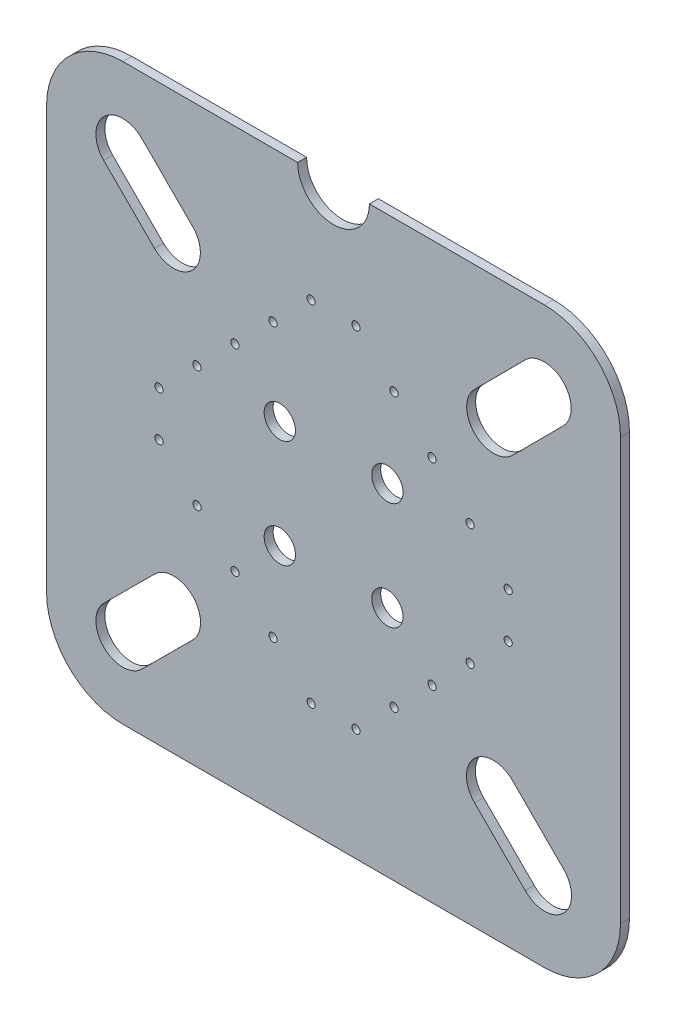
from build123d import *

# Parameters (mm, degrees)
MODEL_R             = 2.892988684
MODEL_R_2           = 2.905821027
MODEL_R_3           = 2.861749312
MODEL_R_4           = 2.905981511
MODEL_R_5           = 2.893543611
MODEL_R_6           = 2.935757592
MODEL_R_7           = 2.935744525
MODEL_R_8           = 2.893530292
MODEL_R_9           = 2.861651924
MODEL_R_10          = 11.087270053
BOSS_EXTRUDE1_DEPTH = 6.35
CUT_EXTRUDE1_DEPTH  = 2.54


with BuildPart() as part:
    # Model → Boss-Extrude1 (new body)
    with BuildSketch(Plane.XY):
        with BuildLine():
            Line((119.414073563, 505.935573635), (-4.340387814, 505.935573635))
            ThreePointArc((-4.340387814, 505.935573635), (-42.545366611, 490.094983884), (-58.385926437, 451.88999268))
            Line((-58.385926437, 451.88999268), (-58.385926437, 153.43999268))
            ThreePointArc((-58.385926437, 153.43999268), (-42.49549311, 115.326303171), (-4.340387814, 99.535573635))
            Line((-4.340387814, 99.535573635), (294.109654519, 99.535573635))
            ThreePointArc((294.109654519, 99.535573635), (332.241277523, 115.308357288), (348.01403123, 153.43999268))
            Line((348.01403123, 153.43999268), (348.01403123, 451.88999268))
            ThreePointArc((348.01403123, 451.88999268), (332.291184592, 490.112786108), (294.109654519, 505.935573635))
            Line((294.109654519, 505.935573635), (170.214073563, 505.935573635))
            ThreePointArc((170.214073563, 505.935573635), (144.814073563, 480.50319667), (119.414073563, 505.935573635))
        make_face()
        with Locations((128.939057314, 426.384157934)):
            Circle(MODEL_R, mode=Mode.SUBTRACT)
        with Locations((75.047030803, 372.505314751)):
            Circle(MODEL_R_2, mode=Mode.SUBTRACT)
        with Locations((21.239223761, 318.616955508)):
            Circle(MODEL_R_3, mode=Mode.SUBTRACT)
        with Locations((48.211432883, 259.91807928)):
            Circle(MODEL_R_4, mode=Mode.SUBTRACT)
        with Locations((101.986830088, 206.039188669)):
            Circle(MODEL_R, mode=Mode.SUBTRACT)
        with Locations((160.687868756, 179.016149355)):
            Circle(MODEL_R_5, mode=Mode.SUBTRACT)
        with Locations((214.593508857, 232.920854631)):
            Circle(MODEL_R, mode=Mode.SUBTRACT)
        with Locations((268.497966772, 286.825266535)):
            Circle(MODEL_R, mode=Mode.SUBTRACT)
        with Locations((241.502840463, 345.512724095)):
            Circle(MODEL_R_6, mode=Mode.SUBTRACT)
        with Locations((187.64130079, 399.361387128)):
            Circle(MODEL_R, mode=Mode.SUBTRACT)
        with Locations((160.689057314, 426.313592106)):
            Circle(MODEL_R, mode=Mode.SUBTRACT)
        with Locations((214.550622723, 372.46493795)):
            Circle(MODEL_R_7, mode=Mode.SUBTRACT)
        with Locations((268.499129579, 318.64606948)):
            Circle(MODEL_R_8, mode=Mode.SUBTRACT)
        with Locations((241.545726759, 259.87305961)):
            Circle(MODEL_R, mode=Mode.SUBTRACT)
        with Locations((187.640099445, 205.968380044)):
            Circle(MODEL_R_5, mode=Mode.SUBTRACT)
        with Locations((128.939057314, 179.086950839)):
            Circle(MODEL_R, mode=Mode.SUBTRACT)
        with Locations((75.066480939, 232.949651351)):
            Circle(MODEL_R_9, mode=Mode.SUBTRACT)
        with Locations((21.259202194, 286.870309969)):
            Circle(MODEL_R_4, mode=Mode.SUBTRACT)
        with Locations((48.094804092, 345.553092265)):
            Circle(MODEL_R_2, mode=Mode.SUBTRACT)
        with Locations((101.986830088, 399.431958602)):
            Circle(MODEL_R, mode=Mode.SUBTRACT)
        with Locations((106.774695343, 264.583450418)):
            Circle(MODEL_R_10, mode=Mode.SUBTRACT)
        with Locations((106.774695343, 340.783450418)):
            Circle(MODEL_R_10, mode=Mode.SUBTRACT)
        with Locations((182.974695343, 340.783450418)):
            Circle(MODEL_R_10, mode=Mode.SUBTRACT)
        with Locations((182.974695343, 264.583450418)):
            Circle(MODEL_R_10, mode=Mode.SUBTRACT)
        with BuildLine():
            Line((9.066553351, 140.029941829), (45.049424385, 175.872912504))
            ThreePointArc((45.049424385, 175.872912504), (45.07410007, 202.856190792), (18.090828408, 202.825103413))
            Line((18.090828408, 202.825103413), (-17.892794492, 166.984536471))
            ThreePointArc((-17.892794492, 166.984536471), (-17.863006922, 140.054981031), (9.066553351, 140.029941829))
        make_face(mode=Mode.SUBTRACT)
        with BuildLine():
            Line((307.51568324, 166.984536471), (271.672861269, 202.825103413))
            ThreePointArc((271.672861269, 202.825103413), (244.518150125, 203.02758894), (244.725237936, 175.872912504))
            Line((244.725237936, 175.872912504), (280.565656163, 140.029941829))
            ThreePointArc((280.565656163, 140.029941829), (307.772462977, 139.777772782), (307.51568324, 166.984536471))
        make_face(mode=Mode.SUBTRACT)
        with BuildLine():
            Line((-17.892794492, 438.483384893), (18.090828408, 402.500365733))
            ThreePointArc((18.090828408, 402.500365733), (44.943120603, 402.601934645), (45.049424385, 429.454208512))
            Line((45.049424385, 429.454208512), (9.066553351, 465.437979535))
            ThreePointArc((9.066553351, 465.437979535), (-17.863006922, 465.412940332), (-17.892794492, 438.483384893))
        make_face(mode=Mode.SUBTRACT)
        with BuildLine():
            Line((280.565656163, 465.437979535), (244.725237936, 429.454208512))
            ThreePointArc((244.725237936, 429.454208512), (244.694238703, 402.475592382), (271.672861269, 402.500365733))
            Line((271.672861269, 402.500365733), (307.51568324, 438.483384893))
            ThreePointArc((307.51568324, 438.483384893), (307.490546582, 465.408279959), (280.565656163, 465.437979535))
        make_face(mode=Mode.SUBTRACT)
    extrude(amount=BOSS_EXTRUDE1_DEPTH)

    # Sketch2 → Cut-Extrude1 (cut)
    # profile 1 of 7: a face of its own
    with BuildSketch(Plane(origin=(0, 0, 0), x_dir=(-1, 0, 0), z_dir=(0, 0, -1))):
        with BuildLine():
            Line((-147.993699699, 133.169886705), (-148.22139401, 133.328255095))
            Line((-148.22139401, 133.328255095), (-147.338601542, 134.618734862))
            add(Edge.make_bspline(
                [(-147.338601542, 134.618734862), (-147.394926709, 134.611846869), (-147.505834104, 134.598284027), (-147.617537046, 134.595792418), (-147.672510797, 134.594566192)],
                knots=[0, 0, 0, 0, 1.015715272, 2, 2, 2, 2], degree=3))
            add(Edge.make_bspline(
                [(-147.672510797, 134.594566192), (-147.705841083, 134.595419883), (-147.77126552, 134.597095604), (-147.867451376, 134.610377815), (-147.959876135, 134.630834003), (-148.048294765, 134.66135823), (-148.133039601, 134.69929332), (-148.213925641, 134.74633504), (-148.290843999, 134.801676461), (-148.362968578, 134.865024961), (-148.428565656, 134.934582908), (-148.48700679, 135.00820267), (-148.535576245, 135.086739443), (-148.575922862, 135.168591143), (-148.606521202, 135.254934225), (-148.628802933, 135.344786181), (-148.642521068, 135.438776742), (-148.644153105, 135.502753111), (-148.64498175, 135.535236264)],
                knots=[0, 0, 0, 0, 1.060718605, 2.082097864, 3.085795603, 4.069760067, 5.054557537, 6.03741023, 7.043284206, 8.066802108, 9.088538119, 10.083643548, 11.053783639, 12.022749082, 12.983451788, 13.964007469, 14.966251758, 16, 16, 16, 16], degree=3))
            add(Edge.make_bspline(
                [(-148.64498175, 135.535236264), (-148.64340837, 135.579657828), (-148.640320144, 135.666848346), (-148.615465775, 135.794241836), (-148.57458961, 135.914698201), (-148.517595297, 136.027900734), (-148.445808799, 136.132221019), (-148.359531721, 136.226208829), (-148.259288839, 136.308527375), (-148.147363722, 136.379288216), (-148.026393482, 136.436197821), (-147.899694056, 136.478143472), (-147.768236247, 136.502816622), (-147.679184146, 136.50606951), (-147.634349739, 136.507707218)],
                knots=[0, 0, 0, 0, 1.022988612, 2.007919123, 2.978103895, 3.94594894, 4.918897164, 5.887013414, 6.875921846, 7.89917871, 8.930658928, 9.948724884, 10.967259574, 12, 12, 12, 12], degree=3))
            add(Edge.make_bspline(
                [(-147.634349739, 136.507707218), (-147.590363815, 136.506046999), (-147.503451776, 136.502766562), (-147.375645321, 136.478741818), (-147.253234541, 136.438249979), (-147.136898017, 136.382293268), (-147.029184408, 136.312152159), (-146.932323493, 136.228572984), (-146.848525683, 136.131503684), (-146.777928305, 136.023291982), (-146.721259054, 135.907026221), (-146.680372055, 135.785665091), (-146.655202796, 135.660081394), (-146.652031128, 135.574996407), (-146.650430468, 135.532056176)],
                knots=[0, 0, 0, 0, 1.026385292, 2.028040595, 3.023318987, 4.028184125, 5.03290303, 6.015178782, 7.004435299, 8.016004309, 9.023023918, 10.015172535, 10.998308025, 12, 12, 12, 12], degree=3))
            add(Edge.make_bspline(
                [(-146.650430468, 135.532056176), (-146.651499453, 135.49872433), (-146.653667622, 135.431119019), (-146.668849844, 135.328402922), (-146.694631012, 135.223672164), (-146.72388791, 135.135024716), (-146.752129234, 135.061810622), (-146.778709546, 135.003978832), (-146.808202714, 134.9431084), (-146.842600451, 134.879837601), (-146.879577677, 134.813359873), (-146.921360021, 134.74434198), (-146.966994361, 134.672691308), (-146.999497035, 134.624388593), (-147.016140604, 134.599654333)],
                knots=[0, 0, 0, 0, 1.179839688, 2.393009684, 3.667231171, 4.993948276, 5.694988576, 6.444077775, 7.246288328, 8.089075292, 8.993003841, 9.939041771, 10.944649915, 12, 12, 12, 12], degree=3))
            Line((-147.016140604, 134.599654333), (-147.993699699, 133.169886705))
        make_face()
        with BuildLine():
            add(Edge.make_bspline(
                [(-147.619721333, 134.920207218), (-147.594471906, 134.920896995), (-147.545319856, 134.922239755), (-147.473313306, 134.930412425), (-147.40534635, 134.944903112), (-147.341237431, 134.965694565), (-147.280343741, 134.990783115), (-147.223632501, 135.022725417), (-147.171056247, 135.060840507), (-147.122262913, 135.103666735), (-147.078934142, 135.151246908), (-147.040341535, 135.201046426), (-147.007538735, 135.253283893), (-146.981627762, 135.308613496), (-146.960323897, 135.365688392), (-146.945611843, 135.4254277), (-146.93746177, 135.487520178), (-146.936072412, 135.529701103), (-146.935366365, 135.551136705)],
                knots=[0, 0, 0, 0, 1.163407946, 2.26475976, 3.333800367, 4.359385343, 5.366239384, 6.363380779, 7.350133999, 8.353570782, 9.349036268, 10.310270964, 11.253520213, 12.184142, 13.120487599, 14.056272588, 15.012232024, 16, 16, 16, 16], degree=3))
            add(Edge.make_bspline(
                [(-146.935366365, 135.551136705), (-146.935973851, 135.572581259), (-146.937170976, 135.614840382), (-146.946775169, 135.677024788), (-146.963670907, 135.736617961), (-146.986340847, 135.793946151), (-147.016204206, 135.848538345), (-147.052039511, 135.901079943), (-147.094613947, 135.951237802), (-147.143601989, 135.997832273), (-147.196429048, 136.040783581), (-147.252726788, 136.078689522), (-147.312031176, 136.11045875), (-147.373980406, 136.136674244), (-147.438703551, 136.157131926), (-147.506162312, 136.171843393), (-147.576697572, 136.179982056), (-147.624577739, 136.181362632), (-147.648978144, 136.182066192)],
                knots=[0, 0, 0, 0, 0.972161553, 1.915763587, 2.844109794, 3.775983486, 4.705125789, 5.659731448, 6.655561913, 7.682237399, 8.721216875, 9.739758359, 10.754845918, 11.767244016, 12.7857855, 13.828538656, 14.893392813, 16, 16, 16, 16], degree=3))
            add(Edge.make_bspline(
                [(-147.648978144, 136.182066192), (-147.673166341, 136.181361495), (-147.720623382, 136.179978885), (-147.790531584, 136.171858863), (-147.857534215, 136.157032988), (-147.922069828, 136.13668372), (-147.984017217, 136.110456794), (-148.043318808, 136.078687857), (-148.099629716, 136.040792307), (-148.152406127, 135.997798478), (-148.201480671, 135.951454684), (-148.243323115, 135.900860217), (-148.279240431, 135.848565677), (-148.309062755, 135.793938887), (-148.33174361, 135.736619899), (-148.348636426, 135.677024263), (-148.358241404, 135.614840518), (-148.359438422, 135.572581305), (-148.360045853, 135.551136705)],
                knots=[0, 0, 0, 0, 1.099389452, 2.15699305, 3.192601482, 4.213358962, 5.227959689, 6.245255729, 7.266013209, 8.307253147, 9.336162325, 10.327954924, 11.284637477, 12.215801273, 13.149702402, 14.080068371, 15.025723358, 16, 16, 16, 16], degree=3))
            add(Edge.make_bspline(
                [(-148.360045853, 135.551136705), (-148.359496191, 135.529684411), (-148.358412158, 135.487376559), (-148.347954806, 135.425213332), (-148.330466652, 135.365624756), (-148.307044776, 135.308031428), (-148.276200477, 135.252993386), (-148.238350986, 135.200771565), (-148.193986669, 135.150773978), (-148.143700577, 135.103777435), (-148.088665888, 135.060640819), (-148.029885983, 135.02296683), (-147.968372773, 134.991151112), (-147.903909723, 134.965622857), (-147.836974554, 134.945110848), (-147.766965685, 134.930439132), (-147.694114641, 134.922318147), (-147.644757015, 134.920917612), (-147.619721333, 134.920207218)],
                knots=[0, 0, 0, 0, 0.952633368, 1.87876736, 2.791047057, 3.707742249, 4.635551637, 5.587206343, 6.568248508, 7.601284464, 8.641511608, 9.671105535, 10.699146789, 11.713763218, 12.747829548, 13.806491675, 14.887386225, 16, 16, 16, 16], degree=3))
        make_face(mode=Mode.SUBTRACT)
    # profile 2 of 7: a face of its own
    with BuildSketch(Plane(origin=(0, 0, 0), x_dir=(-1, 0, 0), z_dir=(0, 0, -1))):
        with BuildLine():
            add(Edge.make_bspline(
                [(-146.243379186, 134.837524926), (-146.243081627, 134.888413271), (-146.242503613, 134.987264614), (-146.236073403, 135.131304968), (-146.225391485, 135.26643323), (-146.210752583, 135.392655868), (-146.192938129, 135.510005469), (-146.169156938, 135.618168427), (-146.142112467, 135.717645356), (-146.110768463, 135.808760643), (-146.075400968, 135.892741845), (-146.036907032, 135.971141849), (-145.993758968, 136.04384203), (-145.948422769, 136.11200274), (-145.899063246, 136.174508235), (-145.847085058, 136.232241222), (-145.790459499, 136.283867402), (-145.731111484, 136.330899405), (-145.668503691, 136.372128569), (-145.604420701, 136.408443982), (-145.538421427, 136.439468147), (-145.470325675, 136.463861614), (-145.400745498, 136.484010025), (-145.329437659, 136.49778857), (-145.256284421, 136.506458051), (-145.206907334, 136.507286879), (-145.181865765, 136.507707218)],
                knots=[0, 0, 0, 0, 1.646270934, 3.197905019, 4.663502075, 6.030701355, 7.308322542, 8.50163776, 9.611534131, 10.641858119, 11.616356847, 12.558055219, 13.465016945, 14.349605745, 15.204443733, 16.039544428, 16.859896111, 17.680448484, 18.487036065, 19.28249412, 20.06191084, 20.843045899, 21.620316918, 22.403196591, 23.190181807, 24, 24, 24, 24], degree=3))
            add(Edge.make_bspline(
                [(-145.181865765, 136.507707218), (-145.156615009, 136.5072647), (-145.106399201, 136.506384671), (-145.032158289, 136.497926523), (-144.959632506, 136.483892004), (-144.889131052, 136.464006549), (-144.820074814, 136.439336185), (-144.75300393, 136.4084143), (-144.687501792, 136.372419899), (-144.624609317, 136.330125382), (-144.563636059, 136.282970031), (-144.506079692, 136.229663896), (-144.451934979, 136.170745222), (-144.40052238, 136.106844388), (-144.353300517, 136.036735775), (-144.308330332, 135.961638762), (-144.268078557, 135.880240049), (-144.229312101, 135.793897767), (-144.195850335, 135.700222876), (-144.165673098, 135.599743415), (-144.141290033, 135.491272546), (-144.120979765, 135.37537938), (-144.105245467, 135.251638306), (-144.093785856, 135.120314577), (-144.087732414, 134.981321794), (-144.086592407, 134.88629146), (-144.086007391, 134.837524926)],
                knots=[0, 0, 0, 0, 0.810914788, 1.612654377, 2.396697861, 3.181598691, 3.963628158, 4.749916497, 5.551656086, 6.361998678, 7.18212741, 8.025565596, 8.878627764, 9.750805457, 10.657531673, 11.591944965, 12.560506719, 13.57287815, 14.630710178, 15.753379473, 16.941251878, 18.199788006, 19.531962791, 20.947069417, 22.433333509, 24, 24, 24, 24], degree=3))
            add(Edge.make_bspline(
                [(-144.086007391, 134.837524926), (-144.086598471, 134.788971096), (-144.087750167, 134.694365936), (-144.093717994, 134.555998552), (-144.105473324, 134.425371755), (-144.120178099, 134.302172264), (-144.14054433, 134.186912853), (-144.165586159, 134.079194675), (-144.19339038, 133.978552552), (-144.227711944, 133.885810973), (-144.265277374, 133.799676196), (-144.306148873, 133.719242426), (-144.349936501, 133.643798718), (-144.397642005, 133.573948947), (-144.448490459, 133.509198308), (-144.503570167, 133.450689751), (-144.561328484, 133.397013498), (-144.622481175, 133.34925095), (-144.686354511, 133.307445449), (-144.751631674, 133.270058599), (-144.819470886, 133.239911797), (-144.888334778, 133.214026438), (-144.959208368, 133.194250314), (-145.032003308, 133.180576174), (-145.106349322, 133.170985997), (-145.156606456, 133.170254405), (-145.181865765, 133.169886705)],
                knots=[0, 0, 0, 0, 1.561518951, 3.042555995, 4.452378317, 5.7783523, 7.031515105, 8.214008947, 9.334062868, 10.386615937, 11.391082383, 12.354592575, 13.286541444, 14.194233754, 15.072674879, 15.931287219, 16.775624067, 17.606195743, 18.42308326, 19.229000347, 20.022332153, 20.807536673, 21.593273796, 22.3848459, 23.188221202, 24, 24, 24, 24], degree=3))
            add(Edge.make_bspline(
                [(-145.181865765, 133.169886705), (-145.206906639, 133.170309756), (-145.256282357, 133.17114393), (-145.329445628, 133.179774244), (-145.400458988, 133.19364945), (-145.469672858, 133.21307737), (-145.537442339, 133.236857971), (-145.602843971, 133.267840241), (-145.666604941, 133.303521861), (-145.728555138, 133.344157708), (-145.787530456, 133.390713806), (-145.843862762, 133.442207125), (-145.896136886, 133.499922648), (-145.944790673, 133.56294905), (-145.991031453, 133.630706491), (-146.033566813, 133.704120087), (-146.072910374, 133.78289874), (-146.108872683, 133.867551416), (-146.140757542, 133.959313387), (-146.168922249, 134.059234427), (-146.191160092, 134.168196469), (-146.21019463, 134.285324366), (-146.225547463, 134.411121431), (-146.236028886, 134.545655959), (-146.242507079, 134.688844112), (-146.243083179, 134.787060265), (-146.243379186, 134.837524926)],
                knots=[0, 0, 0, 0, 0.810891512, 1.598919785, 2.382837074, 3.152667961, 3.926044502, 4.706494248, 5.493654104, 6.291793342, 7.103789334, 7.925228297, 8.761435821, 9.622817696, 10.50288917, 11.416980706, 12.369136599, 13.353924996, 14.394355917, 15.514179734, 16.714354668, 17.994756427, 19.357759367, 20.818452758, 22.365282078, 24, 24, 24, 24], degree=3))
        make_face()
        with BuildLine():
            add(Edge.make_bspline(
                [(-145.958443289, 134.838796962), (-145.958334933, 134.796389213), (-145.958124636, 134.714084101), (-145.952630797, 134.594483429), (-145.945146658, 134.482931773), (-145.935493481, 134.379287494), (-145.921157949, 134.283901411), (-145.905095363, 134.196117484), (-145.885548168, 134.116400276), (-145.862420544, 134.044202762), (-145.836077935, 133.978299679), (-145.807316187, 133.916975719), (-145.776418246, 133.859506463), (-145.741838731, 133.806408118), (-145.704178638, 133.757507526), (-145.66428861, 133.711939171), (-145.620679908, 133.67130191), (-145.560351513, 133.622563977), (-145.480707569, 133.572200191), (-145.380359013, 133.528343381), (-145.277245489, 133.500782153), (-145.207258284, 133.497277174), (-145.1723255, 133.495527731)],
                knots=[0, 0, 0, 0, 1.459021318, 2.831673884, 4.118529203, 5.306027144, 6.411944654, 7.436330062, 8.375795394, 9.233974572, 10.042671642, 10.816086306, 11.563610507, 12.285937304, 12.993564865, 13.685989202, 14.367179055, 15.041617293, 16.353048772, 17.594441528, 18.799311195, 20, 20, 20, 20], degree=3))
            add(Edge.make_bspline(
                [(-145.1723255, 133.495527731), (-145.137166755, 133.496977146), (-145.066921855, 133.499872985), (-144.964293341, 133.527811839), (-144.864661596, 133.56996635), (-144.78658205, 133.619811587), (-144.727180028, 133.667280857), (-144.684619616, 133.707752717), (-144.645556186, 133.753069825), (-144.60850659, 133.801964186), (-144.574525857, 133.85536994), (-144.543625725, 133.913030276), (-144.515428688, 133.975105316), (-144.499364053, 134.018439294), (-144.49115062, 134.040594838)],
                knots=[0, 0, 0, 0, 1.353760809, 2.704726607, 4.075137775, 5.516104923, 6.260822281, 7.007110065, 7.778089737, 8.566572457, 9.372053459, 10.217411131, 11.088608312, 12, 12, 12, 12], degree=3))
            add(Edge.make_bspline(
                [(-144.49115062, 134.040594838), (-144.481578659, 134.068924673), (-144.462143474, 134.126446388), (-144.43709565, 134.215676272), (-144.417369467, 134.309295922), (-144.399622699, 134.40674585), (-144.38750957, 134.508744721), (-144.377759768, 134.614976941), (-144.37201693, 134.725522605), (-144.371305049, 134.80062949), (-144.370943289, 134.838796962)],
                knots=[0, 0, 0, 0, 0.884706709, 1.796334032, 2.740027952, 3.714592787, 4.726048262, 5.777819803, 6.87074269, 8, 8, 8, 8], degree=3))
            add(Edge.make_bspline(
                [(-144.370943289, 134.838796962), (-144.371442389, 134.876958259), (-144.372418736, 134.951609916), (-144.37615071, 135.060937123), (-144.38578781, 135.164775735), (-144.396491296, 135.263573092), (-144.412273061, 135.356782295), (-144.429289072, 135.445183643), (-144.452150171, 135.527681959), (-144.476570253, 135.605568865), (-144.504519683, 135.677959459), (-144.535286099, 135.745191251), (-144.568144409, 135.807588822), (-144.603833441, 135.864980977), (-144.641929525, 135.917624783), (-144.683438159, 135.964464737), (-144.72671284, 136.006952558), (-144.787325573, 136.055450746), (-144.86667725, 136.104900641), (-144.965415802, 136.150408152), (-145.068168458, 136.176541389), (-145.13763152, 136.180225919), (-145.1723255, 136.182066192)],
                knots=[0, 0, 0, 0, 1.31362396, 2.569729283, 3.763502607, 4.902122613, 5.988968491, 7.01645872, 7.998833611, 8.933434873, 9.825090667, 10.667526885, 11.477055099, 12.250526234, 12.991942729, 13.710640831, 14.402115721, 15.076753259, 16.378508321, 17.609869233, 18.806226677, 20, 20, 20, 20], degree=3))
            add(Edge.make_bspline(
                [(-145.1723255, 136.182066192), (-145.207441537, 136.18022338), (-145.277737584, 136.176534398), (-145.381558229, 136.150505518), (-145.481075748, 136.105136613), (-145.560217589, 136.055286961), (-145.620872596, 136.007808636), (-145.663583325, 135.966636638), (-145.703630209, 135.921600393), (-145.740521623, 135.872250085), (-145.775074044, 135.819213644), (-145.80680682, 135.762073836), (-145.835397541, 135.700541099), (-145.86178137, 135.634667618), (-145.884979542, 135.562476333), (-145.90411478, 135.482857317), (-145.921792321, 135.395352601), (-145.934306601, 135.299449905), (-145.945431579, 135.195779665), (-145.952581088, 135.083949527), (-145.958143014, 134.964148267), (-145.958341192, 134.881417602), (-145.958443289, 134.838796962)],
                knots=[0, 0, 0, 0, 1.207732386, 2.417664972, 3.655092373, 4.956220595, 5.625982001, 6.301752483, 6.994047911, 7.697131622, 8.419323945, 9.170223765, 9.943494443, 10.752040957, 11.610060368, 12.549350801, 13.567764191, 14.679664412, 15.874934091, 17.154273443, 18.533957287, 20, 20, 20, 20], degree=3))
        make_face(mode=Mode.SUBTRACT)
    # profile 3 of 7: a face of its own
    with BuildSketch(Plane(origin=(0, 0, 0), x_dir=(-1, 0, 0), z_dir=(0, 0, -1))):
        with BuildLine():
            add(Edge.make_bspline(
                [(-143.801071494, 134.837524926), (-143.800773934, 134.888413271), (-143.800195921, 134.987264614), (-143.793765711, 135.131304968), (-143.783083793, 135.26643323), (-143.76844489, 135.392655868), (-143.750630437, 135.510005469), (-143.726849246, 135.618168427), (-143.699804775, 135.717645356), (-143.66846077, 135.808760643), (-143.633093276, 135.892741845), (-143.594599339, 135.971141849), (-143.551451276, 136.04384203), (-143.506115076, 136.11200274), (-143.456755554, 136.174508235), (-143.404777366, 136.232241222), (-143.348151806, 136.283867402), (-143.288803792, 136.330899405), (-143.226195999, 136.372128569), (-143.162113009, 136.408443982), (-143.096113735, 136.439468147), (-143.028017983, 136.463861614), (-142.958437805, 136.484010025), (-142.887129966, 136.49778857), (-142.813976729, 136.506458051), (-142.764599642, 136.507286879), (-142.739558072, 136.507707218)],
                knots=[0, 0, 0, 0, 1.646270934, 3.197905019, 4.663502075, 6.030701355, 7.308322542, 8.50163776, 9.611534131, 10.641858119, 11.616356847, 12.558055219, 13.465016945, 14.349605745, 15.204443733, 16.039544428, 16.859896111, 17.680448484, 18.487036065, 19.28249412, 20.06191084, 20.843045899, 21.620316918, 22.403196591, 23.190181807, 24, 24, 24, 24], degree=3))
            add(Edge.make_bspline(
                [(-142.739558072, 136.507707218), (-142.714307317, 136.5072647), (-142.664091509, 136.506384671), (-142.589850597, 136.497926523), (-142.517324814, 136.483892004), (-142.44682336, 136.464006549), (-142.377767122, 136.439336185), (-142.310696238, 136.4084143), (-142.2451941, 136.372419899), (-142.182301624, 136.330125382), (-142.121328366, 136.282970031), (-142.063772, 136.229663896), (-142.009627286, 136.170745222), (-141.958214688, 136.106844388), (-141.910992825, 136.036735775), (-141.86602264, 135.961638762), (-141.825770864, 135.880240049), (-141.787004409, 135.793897767), (-141.753542642, 135.700222876), (-141.723365406, 135.599743415), (-141.698982341, 135.491272546), (-141.678672073, 135.37537938), (-141.662937774, 135.251638306), (-141.651478163, 135.120314577), (-141.645424722, 134.981321794), (-141.644284714, 134.88629146), (-141.643699699, 134.837524926)],
                knots=[0, 0, 0, 0, 0.810914788, 1.612654377, 2.396697861, 3.181598691, 3.963628158, 4.749916497, 5.551656086, 6.361998678, 7.18212741, 8.025565596, 8.878627764, 9.750805457, 10.657531673, 11.591944965, 12.560506719, 13.57287815, 14.630710178, 15.753379473, 16.941251878, 18.199788006, 19.531962791, 20.947069417, 22.433333509, 24, 24, 24, 24], degree=3))
            add(Edge.make_bspline(
                [(-141.643699699, 134.837524926), (-141.644290779, 134.788971096), (-141.645442475, 134.694365936), (-141.651410302, 134.555998552), (-141.663165631, 134.425371755), (-141.677870407, 134.302172264), (-141.698236637, 134.186912853), (-141.723278467, 134.079194675), (-141.751082688, 133.978552552), (-141.785404251, 133.885810973), (-141.822969681, 133.799676196), (-141.863841181, 133.719242426), (-141.907628809, 133.643798718), (-141.955334313, 133.573948947), (-142.006182766, 133.509198308), (-142.061262475, 133.450689751), (-142.119020791, 133.397013498), (-142.180173483, 133.34925095), (-142.244046819, 133.307445449), (-142.309323981, 133.270058599), (-142.377163193, 133.239911797), (-142.446027086, 133.214026438), (-142.516900675, 133.194250314), (-142.589695616, 133.180576174), (-142.66404163, 133.170985997), (-142.714298764, 133.170254405), (-142.739558072, 133.169886705)],
                knots=[0, 0, 0, 0, 1.561518951, 3.042555995, 4.452378317, 5.7783523, 7.031515105, 8.214008947, 9.334062868, 10.386615937, 11.391082383, 12.354592575, 13.286541444, 14.194233754, 15.072674879, 15.931287219, 16.775624067, 17.606195743, 18.42308326, 19.229000347, 20.022332153, 20.807536673, 21.593273796, 22.3848459, 23.188221202, 24, 24, 24, 24], degree=3))
            add(Edge.make_bspline(
                [(-142.739558072, 133.169886705), (-142.764598947, 133.170309756), (-142.813974665, 133.17114393), (-142.887137936, 133.179774244), (-142.958151296, 133.19364945), (-143.027365165, 133.21307737), (-143.095134647, 133.236857971), (-143.160536278, 133.267840241), (-143.224297249, 133.303521861), (-143.286247446, 133.344157708), (-143.345222763, 133.390713806), (-143.40155507, 133.442207125), (-143.453829194, 133.499922648), (-143.502482981, 133.56294905), (-143.548723761, 133.630706491), (-143.591259121, 133.704120087), (-143.630602681, 133.78289874), (-143.666564991, 133.867551416), (-143.69844985, 133.959313387), (-143.726614556, 134.059234427), (-143.748852399, 134.168196469), (-143.767886937, 134.285324366), (-143.78323977, 134.411121431), (-143.793721194, 134.545655959), (-143.800199387, 134.688844112), (-143.800775487, 134.787060265), (-143.801071494, 134.837524926)],
                knots=[0, 0, 0, 0, 0.810891512, 1.598919785, 2.382837074, 3.152667961, 3.926044502, 4.706494248, 5.493654104, 6.291793342, 7.103789334, 7.925228297, 8.761435821, 9.622817696, 10.50288917, 11.416980706, 12.369136599, 13.353924996, 14.394355917, 15.514179734, 16.714354668, 17.994756427, 19.357759367, 20.818452758, 22.365282078, 24, 24, 24, 24], degree=3))
        make_face()
        with BuildLine():
            add(Edge.make_bspline(
                [(-143.516135596, 134.838796962), (-143.516027241, 134.796389213), (-143.515816944, 134.714084101), (-143.510323105, 134.594483429), (-143.502838966, 134.482931773), (-143.493185789, 134.379287494), (-143.478850257, 134.283901411), (-143.462787671, 134.196117484), (-143.443240475, 134.116400276), (-143.420112852, 134.044202762), (-143.393770243, 133.978299679), (-143.365008495, 133.916975719), (-143.334110554, 133.859506463), (-143.299531038, 133.806408118), (-143.261870945, 133.757507526), (-143.221980917, 133.711939171), (-143.178372216, 133.67130191), (-143.118043821, 133.622563977), (-143.038399876, 133.572200191), (-142.93805132, 133.528343381), (-142.834937797, 133.500782153), (-142.764950592, 133.497277174), (-142.730017808, 133.495527731)],
                knots=[0, 0, 0, 0, 1.459021318, 2.831673884, 4.118529203, 5.306027144, 6.411944654, 7.436330062, 8.375795394, 9.233974572, 10.042671642, 10.816086306, 11.563610507, 12.285937304, 12.993564865, 13.685989202, 14.367179055, 15.041617293, 16.353048772, 17.594441528, 18.799311195, 20, 20, 20, 20], degree=3))
            add(Edge.make_bspline(
                [(-142.730017808, 133.495527731), (-142.694859063, 133.496977146), (-142.624614162, 133.499872985), (-142.521985648, 133.527811839), (-142.422353903, 133.56996635), (-142.344274357, 133.619811587), (-142.284872336, 133.667280857), (-142.242311923, 133.707752717), (-142.203248494, 133.753069825), (-142.166198897, 133.801964186), (-142.132218164, 133.85536994), (-142.101318032, 133.913030276), (-142.073120996, 133.975105316), (-142.057056361, 134.018439294), (-142.048842928, 134.040594838)],
                knots=[0, 0, 0, 0, 1.353760809, 2.704726607, 4.075137775, 5.516104923, 6.260822281, 7.007110065, 7.778089737, 8.566572457, 9.372053459, 10.217411131, 11.088608312, 12, 12, 12, 12], degree=3))
            add(Edge.make_bspline(
                [(-142.048842928, 134.040594838), (-142.039270967, 134.068924673), (-142.019835782, 134.126446388), (-141.994787958, 134.215676272), (-141.975061774, 134.309295922), (-141.957315007, 134.40674585), (-141.945201878, 134.508744721), (-141.935452076, 134.614976941), (-141.929709238, 134.725522605), (-141.928997357, 134.80062949), (-141.928635596, 134.838796962)],
                knots=[0, 0, 0, 0, 0.884706709, 1.796334032, 2.740027952, 3.714592787, 4.726048262, 5.777819803, 6.87074269, 8, 8, 8, 8], degree=3))
            add(Edge.make_bspline(
                [(-141.928635596, 134.838796962), (-141.929134696, 134.876958259), (-141.930111043, 134.951609916), (-141.933843018, 135.060937123), (-141.943480118, 135.164775735), (-141.954183604, 135.263573092), (-141.969965369, 135.356782295), (-141.986981379, 135.445183643), (-142.009842479, 135.527681959), (-142.034262561, 135.605568865), (-142.062211991, 135.677959459), (-142.092978407, 135.745191251), (-142.125836717, 135.807588822), (-142.161525749, 135.864980977), (-142.199621833, 135.917624783), (-142.241130467, 135.964464737), (-142.284405148, 136.006952558), (-142.345017881, 136.055450746), (-142.424369558, 136.104900641), (-142.523108109, 136.150408152), (-142.625860765, 136.176541389), (-142.695323827, 136.180225919), (-142.730017808, 136.182066192)],
                knots=[0, 0, 0, 0, 1.31362396, 2.569729283, 3.763502607, 4.902122613, 5.988968491, 7.01645872, 7.998833611, 8.933434873, 9.825090667, 10.667526885, 11.477055099, 12.250526234, 12.991942729, 13.710640831, 14.402115721, 15.076753259, 16.378508321, 17.609869233, 18.806226677, 20, 20, 20, 20], degree=3))
            add(Edge.make_bspline(
                [(-142.730017808, 136.182066192), (-142.765133845, 136.18022338), (-142.835429892, 136.176534398), (-142.939250537, 136.150505518), (-143.038768056, 136.105136613), (-143.117909897, 136.055286961), (-143.178564903, 136.007808636), (-143.221275632, 135.966636638), (-143.261322517, 135.921600393), (-143.298213931, 135.872250085), (-143.332766352, 135.819213644), (-143.364499128, 135.762073836), (-143.393089848, 135.700541099), (-143.419473678, 135.634667618), (-143.442671849, 135.562476333), (-143.461807088, 135.482857317), (-143.479484629, 135.395352601), (-143.491998908, 135.299449905), (-143.503123887, 135.195779665), (-143.510273395, 135.083949527), (-143.515835322, 134.964148267), (-143.5160335, 134.881417602), (-143.516135596, 134.838796962)],
                knots=[0, 0, 0, 0, 1.207732386, 2.417664972, 3.655092373, 4.956220595, 5.625982001, 6.301752483, 6.994047911, 7.697131622, 8.419323945, 9.170223765, 9.943494443, 10.752040957, 11.610060368, 12.549350801, 13.567764191, 14.679664412, 15.874934091, 17.154273443, 18.533957287, 20, 20, 20, 20], degree=3))
        make_face(mode=Mode.SUBTRACT)
    # profile 4 of 7: a face of its own
    with BuildSketch(Plane(origin=(0, 0, 0), x_dir=(-1, 0, 0), z_dir=(0, 0, -1))):
        with BuildLine():
            Line((-139.364212519, 136.426296962), (-139.364212519, 136.100655936))
            Line((-139.364212519, 136.100655936), (-140.443534434, 136.100655936))
            Line((-140.443534434, 136.100655936), (-140.615259194, 135.26556479))
            add(Edge.make_bspline(
                [(-140.615259194, 135.26556479), (-140.581644222, 135.274845108), (-140.516520531, 135.292824256), (-140.4203998, 135.312786634), (-140.329148301, 135.324820287), (-140.269934215, 135.326463404), (-140.241280829, 135.3272585)],
                knots=[0, 0, 0, 0, 1.100273476, 2.13160584, 3.095893838, 4, 4, 4, 4], degree=3))
            add(Edge.make_bspline(
                [(-140.241280829, 135.3272585), (-140.205826293, 135.326491116), (-140.136113819, 135.324982246), (-140.034115631, 135.310493497), (-139.936749364, 135.287688003), (-139.844218642, 135.255828672), (-139.756352285, 135.215089129), (-139.673958712, 135.164198468), (-139.595801176, 135.104750375), (-139.523281823, 135.036401686), (-139.457491915, 134.961179933), (-139.399647053, 134.880301007), (-139.350513846, 134.794550914), (-139.310998019, 134.703110362), (-139.279443658, 134.606990273), (-139.258441491, 134.505179287), (-139.244456334, 134.398637064), (-139.242893884, 134.325789347), (-139.242097135, 134.288641713)],
                knots=[0, 0, 0, 0, 1.052922333, 2.070308379, 3.05430497, 4.020497103, 4.973039431, 5.925935799, 6.892292201, 7.88610001, 8.88166317, 9.857072816, 10.836096531, 11.812156883, 12.81219415, 13.836441305, 14.89672472, 16, 16, 16, 16], degree=3))
            add(Edge.make_bspline(
                [(-139.242097135, 134.288641713), (-139.242700453, 134.262767985), (-139.243898936, 134.211370189), (-139.249993655, 134.135039378), (-139.261728197, 134.060324522), (-139.277483204, 133.98721571), (-139.297932398, 133.915851351), (-139.322687468, 133.846027179), (-139.352982436, 133.778177786), (-139.386212326, 133.711661177), (-139.423628774, 133.647981103), (-139.46515642, 133.588428094), (-139.50903083, 133.532108781), (-139.556239801, 133.479627181), (-139.607222132, 133.431328157), (-139.661360388, 133.386925073), (-139.718222569, 133.34566701), (-139.778688396, 133.309228718), (-139.841410505, 133.275698037), (-139.907294674, 133.248190256), (-139.974841166, 133.223597134), (-140.045022161, 133.203994206), (-140.117678691, 133.18863396), (-140.192930523, 133.178201272), (-140.270382988, 133.170602647), (-140.322883892, 133.17012698), (-140.349403825, 133.169886705)],
                knots=[0, 0, 0, 0, 1.056347294, 2.098418968, 3.122841568, 4.141288669, 5.149314143, 6.15115421, 7.162517403, 8.180376062, 9.185164535, 10.17417709, 11.141909838, 12.097768115, 13.052685741, 14.0056014, 14.954263652, 15.917497458, 16.885230207, 17.854509472, 18.828990115, 19.81800267, 20.826176721, 21.857883937, 22.917946725, 24, 24, 24, 24], degree=3))
            add(Edge.make_bspline(
                [(-140.349403825, 133.169886705), (-140.381039689, 133.170513394), (-140.443279514, 133.17174633), (-140.534466029, 133.184644527), (-140.622199992, 133.203117509), (-140.705775156, 133.230908982), (-140.785940516, 133.265731742), (-140.861616839, 133.309742841), (-140.934737793, 133.359616742), (-141.002330855, 133.418472491), (-141.065065329, 133.482803145), (-141.121223376, 133.55261472), (-141.171237407, 133.626754999), (-141.214306506, 133.705584039), (-141.251043997, 133.788894706), (-141.279904736, 133.876999143), (-141.303198672, 133.969437003), (-141.313053347, 134.033076259), (-141.318058673, 134.065399526)],
                knots=[0, 0, 0, 0, 1.0467383, 2.05933395, 3.04377827, 4.011590433, 4.970194871, 5.932262533, 6.905835911, 7.896367577, 8.894135286, 9.877477877, 10.858688626, 11.851381753, 12.8477658, 13.868841284, 14.917554742, 16, 16, 16, 16], degree=3))
            Line((-141.318058673, 134.065399526), (-141.033122776, 134.065399526))
            add(Edge.make_bspline(
                [(-141.033122776, 134.065399526), (-141.02611187, 134.035122315), (-141.01263652, 133.976927836), (-140.983058448, 133.895165833), (-140.946894404, 133.822304823), (-140.903891888, 133.757380987), (-140.852592932, 133.700767111), (-140.794055521, 133.65031449), (-140.728425801, 133.60479848), (-140.655497657, 133.566859256), (-140.578560078, 133.534502601), (-140.498035537, 133.51295642), (-140.416116594, 133.497806325), (-140.360709787, 133.496289799), (-140.332867367, 133.495527731)],
                knots=[0, 0, 0, 0, 1.136247022, 2.183929868, 3.172523383, 4.106158343, 5.02341133, 5.958108904, 6.928429099, 7.938127109, 8.96079061, 9.975095812, 10.982467395, 12, 12, 12, 12], degree=3))
            add(Edge.make_bspline(
                [(-140.332867367, 133.495527731), (-140.305690778, 133.496272294), (-140.252179852, 133.497738344), (-140.173429523, 133.509022305), (-140.097399273, 133.526400959), (-140.024839313, 133.552408613), (-139.954479917, 133.58401775), (-139.888100854, 133.624580712), (-139.823781815, 133.6712623), (-139.763522008, 133.724744386), (-139.708331936, 133.78368118), (-139.659567455, 133.846707102), (-139.618948398, 133.91394167), (-139.584718171, 133.984220887), (-139.558725535, 134.058315007), (-139.540182645, 134.135876787), (-139.529294156, 134.217097805), (-139.5277963, 134.272496393), (-139.527033032, 134.300726048)],
                knots=[0, 0, 0, 0, 1.027316725, 2.022795036, 3.002884548, 3.971462791, 4.93288096, 5.914575861, 6.907176829, 7.935150275, 8.956128384, 9.956726525, 10.942570165, 11.921478529, 12.907843606, 13.90538589, 14.932640048, 16, 16, 16, 16], degree=3))
            add(Edge.make_bspline(
                [(-139.527033032, 134.300726048), (-139.527630367, 134.326194766), (-139.528799565, 134.376046156), (-139.538352297, 134.448979722), (-139.554968408, 134.517988839), (-139.578031499, 134.583406751), (-139.607313623, 134.64529516), (-139.643097064, 134.703717936), (-139.686053361, 134.757905056), (-139.735122431, 134.807881873), (-139.78887794, 134.854005438), (-139.848244763, 134.893324716), (-139.911980554, 134.926402698), (-139.979317405, 134.954948668), (-140.051856991, 134.975450773), (-140.128162794, 134.990843069), (-140.209058807, 134.999747005), (-140.264367932, 135.000982433), (-140.292798257, 135.001617474)],
                knots=[0, 0, 0, 0, 1.045622112, 2.046656509, 3.013763289, 3.955457236, 4.890082067, 5.820317437, 6.762574623, 7.722996705, 8.69280354, 9.665887285, 10.63943826, 11.638615906, 12.663482002, 13.728887084, 14.832589034, 16, 16, 16, 16], degree=3))
            add(Edge.make_bspline(
                [(-140.292798257, 135.001617474), (-140.31740807, 135.001090795), (-140.368221093, 135.000003337), (-140.446165371, 134.991996443), (-140.528072863, 134.979079369), (-140.613629584, 134.961311844), (-140.703092473, 134.938060796), (-140.796272737, 134.910198356), (-140.893366293, 134.876886257), (-140.958787372, 134.851729178), (-140.992417648, 134.838796962)],
                knots=[0, 0, 0, 0, 0.817624296, 1.688186739, 2.600797293, 3.572016777, 4.590301741, 5.671205678, 6.80286297, 8, 8, 8, 8], degree=3))
            Line((-140.992417648, 134.838796962), (-140.666776622, 136.426296962))
            Line((-140.666776622, 136.426296962), (-139.364212519, 136.426296962))
        make_face()
    # profile 5 of 7: a face of its own
    with BuildSketch(Plane(origin=(0, 0, 0), x_dir=(-1, 0, 0), z_dir=(0, 0, -1))):
        with BuildLine():
            Line((-136.921904827, 136.426296962), (-136.921904827, 136.100655936))
            Line((-136.921904827, 136.100655936), (-138.001226742, 136.100655936))
            Line((-138.001226742, 136.100655936), (-138.172951502, 135.26556479))
            add(Edge.make_bspline(
                [(-138.172951502, 135.26556479), (-138.13933653, 135.274845108), (-138.074212839, 135.292824256), (-137.978092108, 135.312786634), (-137.886840609, 135.324820287), (-137.827626523, 135.326463404), (-137.798973136, 135.3272585)],
                knots=[0, 0, 0, 0, 1.100273476, 2.13160584, 3.095893838, 4, 4, 4, 4], degree=3))
            add(Edge.make_bspline(
                [(-137.798973136, 135.3272585), (-137.763518601, 135.326491116), (-137.693806126, 135.324982246), (-137.591807939, 135.310493497), (-137.494441671, 135.287688003), (-137.40191095, 135.255828672), (-137.314044593, 135.215089129), (-137.231651019, 135.164198468), (-137.153493484, 135.104750375), (-137.080974131, 135.036401686), (-137.015184223, 134.961179933), (-136.957339361, 134.880301007), (-136.908206154, 134.794550914), (-136.868690326, 134.703110362), (-136.837135966, 134.606990273), (-136.816133799, 134.505179287), (-136.802148642, 134.398637064), (-136.800586191, 134.325789347), (-136.799789442, 134.288641713)],
                knots=[0, 0, 0, 0, 1.052922333, 2.070308379, 3.05430497, 4.020497103, 4.973039431, 5.925935799, 6.892292201, 7.88610001, 8.88166317, 9.857072816, 10.836096531, 11.812156883, 12.81219415, 13.836441305, 14.89672472, 16, 16, 16, 16], degree=3))
            add(Edge.make_bspline(
                [(-136.799789442, 134.288641713), (-136.800392761, 134.262767985), (-136.801591244, 134.211370189), (-136.807685963, 134.135039378), (-136.819420505, 134.060324522), (-136.835175512, 133.98721571), (-136.855624705, 133.915851351), (-136.880379776, 133.846027179), (-136.910674744, 133.778177786), (-136.943904634, 133.711661177), (-136.981321082, 133.647981103), (-137.022848728, 133.588428094), (-137.066723138, 133.532108781), (-137.113932109, 133.479627181), (-137.16491444, 133.431328157), (-137.219052696, 133.386925073), (-137.275914877, 133.34566701), (-137.336380704, 133.309228718), (-137.399102813, 133.275698037), (-137.464986982, 133.248190256), (-137.532533474, 133.223597134), (-137.602714468, 133.203994206), (-137.675370998, 133.18863396), (-137.75062283, 133.178201272), (-137.828075295, 133.170602647), (-137.8805762, 133.17012698), (-137.907096133, 133.169886705)],
                knots=[0, 0, 0, 0, 1.056347294, 2.098418968, 3.122841568, 4.141288669, 5.149314143, 6.15115421, 7.162517403, 8.180376062, 9.185164535, 10.17417709, 11.141909838, 12.097768115, 13.052685741, 14.0056014, 14.954263652, 15.917497458, 16.885230207, 17.854509472, 18.828990115, 19.81800267, 20.826176721, 21.857883937, 22.917946725, 24, 24, 24, 24], degree=3))
            add(Edge.make_bspline(
                [(-137.907096133, 133.169886705), (-137.938731997, 133.170513394), (-138.000971822, 133.17174633), (-138.092158336, 133.184644527), (-138.1798923, 133.203117509), (-138.263467463, 133.230908982), (-138.343632824, 133.265731742), (-138.419309147, 133.309742841), (-138.492430101, 133.359616742), (-138.560023162, 133.418472491), (-138.622757637, 133.482803145), (-138.678915684, 133.55261472), (-138.728929714, 133.626754999), (-138.771998814, 133.705584039), (-138.808736304, 133.788894706), (-138.837597044, 133.876999143), (-138.86089098, 133.969437003), (-138.870745654, 134.033076259), (-138.875750981, 134.065399526)],
                knots=[0, 0, 0, 0, 1.0467383, 2.05933395, 3.04377827, 4.011590433, 4.970194871, 5.932262533, 6.905835911, 7.896367577, 8.894135286, 9.877477877, 10.858688626, 11.851381753, 12.8477658, 13.868841284, 14.917554742, 16, 16, 16, 16], degree=3))
            Line((-138.875750981, 134.065399526), (-138.590815083, 134.065399526))
            add(Edge.make_bspline(
                [(-138.590815083, 134.065399526), (-138.583804178, 134.035122315), (-138.570328828, 133.976927836), (-138.540750756, 133.895165833), (-138.504586712, 133.822304823), (-138.461584196, 133.757380987), (-138.410285239, 133.700767111), (-138.351747829, 133.65031449), (-138.286118108, 133.60479848), (-138.213189965, 133.566859256), (-138.136252385, 133.534502601), (-138.055727845, 133.51295642), (-137.973808902, 133.497806325), (-137.918402095, 133.496289799), (-137.890559675, 133.495527731)],
                knots=[0, 0, 0, 0, 1.136247022, 2.183929868, 3.172523383, 4.106158343, 5.02341133, 5.958108904, 6.928429099, 7.938127109, 8.96079061, 9.975095812, 10.982467395, 12, 12, 12, 12], degree=3))
            add(Edge.make_bspline(
                [(-137.890559675, 133.495527731), (-137.863383086, 133.496272294), (-137.80987216, 133.497738344), (-137.731121831, 133.509022305), (-137.655091581, 133.526400959), (-137.582531621, 133.552408613), (-137.512172225, 133.58401775), (-137.445793161, 133.624580712), (-137.381474123, 133.6712623), (-137.321214316, 133.724744386), (-137.266024244, 133.78368118), (-137.217259763, 133.846707102), (-137.176640706, 133.91394167), (-137.142410478, 133.984220887), (-137.116417843, 134.058315007), (-137.097874953, 134.135876787), (-137.086986464, 134.217097805), (-137.085488608, 134.272496393), (-137.08472534, 134.300726048)],
                knots=[0, 0, 0, 0, 1.027316725, 2.022795036, 3.002884548, 3.971462791, 4.93288096, 5.914575861, 6.907176829, 7.935150275, 8.956128384, 9.956726525, 10.942570165, 11.921478529, 12.907843606, 13.90538589, 14.932640048, 16, 16, 16, 16], degree=3))
            add(Edge.make_bspline(
                [(-137.08472534, 134.300726048), (-137.085322675, 134.326194766), (-137.086491873, 134.376046156), (-137.096044605, 134.448979722), (-137.112660715, 134.517988839), (-137.135723806, 134.583406751), (-137.165005931, 134.64529516), (-137.200789372, 134.703717936), (-137.243745668, 134.757905056), (-137.292814739, 134.807881873), (-137.346570247, 134.854005438), (-137.405937071, 134.893324716), (-137.469672862, 134.926402698), (-137.537009713, 134.954948668), (-137.609549299, 134.975450773), (-137.685855101, 134.990843069), (-137.766751115, 134.999747005), (-137.822060239, 135.000982433), (-137.850490564, 135.001617474)],
                knots=[0, 0, 0, 0, 1.045622112, 2.046656509, 3.013763289, 3.955457236, 4.890082067, 5.820317437, 6.762574623, 7.722996705, 8.69280354, 9.665887285, 10.63943826, 11.638615906, 12.663482002, 13.728887084, 14.832589034, 16, 16, 16, 16], degree=3))
            add(Edge.make_bspline(
                [(-137.850490564, 135.001617474), (-137.875100378, 135.001090795), (-137.925913401, 135.000003337), (-138.003857679, 134.991996443), (-138.085765171, 134.979079369), (-138.171321892, 134.961311844), (-138.260784781, 134.938060796), (-138.353965045, 134.910198356), (-138.451058601, 134.876886257), (-138.516479679, 134.851729178), (-138.550109955, 134.838796962)],
                knots=[0, 0, 0, 0, 0.817624296, 1.688186739, 2.600797293, 3.572016777, 4.590301741, 5.671205678, 6.80286297, 8, 8, 8, 8], degree=3))
            Line((-138.550109955, 134.838796962), (-138.22446893, 136.426296962))
            Line((-138.22446893, 136.426296962), (-136.921904827, 136.426296962))
        make_face()
    # profile 6 of 7: a face of its own
    with BuildSketch(Plane(origin=(0, 0, 0), x_dir=(-1, 0, 0), z_dir=(0, 0, -1))):
        with BuildLine():
            Line((-136.067097135, 135.693604654), (-136.352033032, 135.693604654))
            add(Edge.make_bspline(
                [(-136.352033032, 135.693604654), (-136.344313654, 135.72556555), (-136.329222901, 135.788046488), (-136.297747245, 135.877315932), (-136.263457921, 135.961792269), (-136.222283519, 136.039893707), (-136.177372006, 136.113189855), (-136.125916394, 136.180018275), (-136.070290646, 136.242078608), (-136.008763728, 136.297154187), (-135.944239871, 136.347026842), (-135.875809894, 136.389549215), (-135.804850555, 136.426128983), (-135.730870213, 136.456264479), (-135.653648614, 136.478966204), (-135.573883884, 136.49543702), (-135.491366995, 136.506133245), (-135.435353109, 136.507177152), (-135.406910837, 136.507707218)],
                knots=[0, 0, 0, 0, 1.162005537, 2.271625781, 3.343758855, 4.383309926, 5.390229558, 6.379919256, 7.361854164, 8.333198761, 9.295911338, 10.242430842, 11.177959212, 12.116337295, 13.062827104, 14.020064771, 14.994644689, 16, 16, 16, 16], degree=3))
            add(Edge.make_bspline(
                [(-135.406910837, 136.507707218), (-135.365470063, 136.506456059), (-135.283492461, 136.503981033), (-135.163057411, 136.48138008), (-135.046918796, 136.445615852), (-134.936347836, 136.3962004), (-134.833642544, 136.335251909), (-134.742260431, 136.262712469), (-134.663440139, 136.179981674), (-134.597314525, 136.088602848), (-134.545539348, 135.990943921), (-134.507360995, 135.89043235), (-134.48411847, 135.787306562), (-134.48110625, 135.717676744), (-134.479597135, 135.682792354)],
                knots=[0, 0, 0, 0, 1.083050992, 2.142477498, 3.193116406, 4.255571735, 5.30263384, 6.308962982, 7.297363603, 8.282367274, 9.249857812, 10.179914175, 11.08814088, 12, 12, 12, 12], degree=3))
            add(Edge.make_bspline(
                [(-134.479597135, 135.682792354), (-134.480652678, 135.649221905), (-134.482718212, 135.583529745), (-134.500256645, 135.487625244), (-134.529771684, 135.397236078), (-134.570656397, 135.311981738), (-134.623580518, 135.232402776), (-134.68769075, 135.158320146), (-134.763439593, 135.089405267), (-134.82084263, 135.049926888), (-134.850395412, 135.02960225)],
                knots=[0, 0, 0, 0, 1.024540389, 2.004866551, 2.965041327, 3.920577974, 4.882998113, 5.874504559, 6.905732034, 8, 8, 8, 8], degree=3))
            add(Edge.make_bspline(
                [(-134.850395412, 135.02960225), (-134.816620892, 135.01329348), (-134.749703799, 134.98098109), (-134.658490104, 134.917611939), (-134.575688031, 134.844445109), (-134.529511086, 134.787347131), (-134.506309875, 134.75865874)],
                knots=[0, 0, 0, 0, 1.015518401, 2.012035669, 3.001164323, 4, 4, 4, 4], degree=3))
            add(Edge.make_bspline(
                [(-134.506309875, 134.75865874), (-134.491032372, 134.737742066), (-134.460727545, 134.696251241), (-134.423321025, 134.629543198), (-134.389385614, 134.562095776), (-134.362942201, 134.492101171), (-134.342464478, 134.420370652), (-134.327826792, 134.34678105), (-134.318733464, 134.271272272), (-134.317431214, 134.220188808), (-134.316776622, 134.194511104)],
                knots=[0, 0, 0, 0, 1.025084078, 2.033381695, 3.024893161, 4.013698104, 4.991890475, 5.976764909, 6.982997093, 8, 8, 8, 8], degree=3))
            add(Edge.make_bspline(
                [(-134.316776622, 134.194511104), (-134.318404502, 134.150052286), (-134.321652601, 134.061343873), (-134.350684869, 133.930284661), (-134.395691166, 133.802172955), (-134.459605672, 133.67964078), (-134.537499769, 133.56499572), (-134.630171056, 133.462419354), (-134.736566584, 133.374246334), (-134.855225994, 133.300577056), (-134.983783675, 133.241687226), (-135.12128439, 133.200813689), (-135.265746939, 133.174192675), (-135.364813559, 133.171338015), (-135.415179066, 133.169886705)],
                knots=[0, 0, 0, 0, 0.955779014, 1.907060117, 2.875433937, 3.871313158, 4.872415639, 5.851225146, 6.836215519, 7.83643374, 8.849228613, 9.86973379, 10.916971861, 12, 12, 12, 12], degree=3))
            add(Edge.make_bspline(
                [(-135.415179066, 133.169886705), (-135.449123717, 133.170674299), (-135.515915471, 133.17222402), (-135.614107787, 133.18281818), (-135.707835329, 133.202167541), (-135.797224821, 133.22820554), (-135.882355675, 133.261218049), (-135.962968114, 133.302328582), (-136.039558088, 133.35068973), (-136.111402851, 133.406872342), (-136.178493838, 133.469720415), (-136.239048095, 133.540349659), (-136.294075193, 133.617454447), (-136.342101729, 133.701930362), (-136.38531525, 133.792685703), (-136.420857975, 133.890882555), (-136.452141313, 133.995643061), (-136.466685955, 134.068647868), (-136.474148417, 134.106104654)],
                knots=[0, 0, 0, 0, 1.048658725, 2.063410685, 3.046034179, 4.001477787, 4.936774919, 5.862367409, 6.792675028, 7.730719943, 8.675894397, 9.627829632, 10.600096036, 11.597688215, 12.626045268, 13.701542398, 14.82072376, 16, 16, 16, 16], degree=3))
            Line((-136.474148417, 134.106104654), (-136.189212519, 134.106104654))
            add(Edge.make_bspline(
                [(-136.189212519, 134.106104654), (-136.181789105, 134.081658049), (-136.167349919, 134.034107279), (-136.14277152, 133.965672145), (-136.114769588, 133.902935911), (-136.084729952, 133.845438364), (-136.053180933, 133.792613256), (-136.017879537, 133.745857418), (-135.981440384, 133.703117199), (-135.953972685, 133.679037444), (-135.940529627, 133.66725249)],
                knots=[0, 0, 0, 0, 1.198163088, 2.33053128, 3.407730985, 4.417276592, 5.372219308, 6.28897303, 7.162600585, 8, 8, 8, 8], degree=3))
            add(Edge.make_bspline(
                [(-135.940529627, 133.66725249), (-135.922752732, 133.653547073), (-135.887253817, 133.626178544), (-135.829406921, 133.591252067), (-135.768569489, 133.560988851), (-135.70342332, 133.537871499), (-135.635374207, 133.518297478), (-135.56332224, 133.50548815), (-135.487903093, 133.496699594), (-135.436406622, 133.495924049), (-135.410090925, 133.495527731)],
                knots=[0, 0, 0, 0, 0.946170439, 1.889420265, 2.845303464, 3.807233317, 4.801018734, 5.828864929, 6.890507805, 8, 8, 8, 8], degree=3))
            add(Edge.make_bspline(
                [(-135.410090925, 133.495527731), (-135.380378819, 133.496086445), (-135.322279361, 133.497178962), (-135.237502452, 133.50722621), (-135.156850696, 133.5218588), (-135.081219542, 133.544458434), (-135.009618296, 133.572381064), (-134.943050657, 133.607440689), (-134.880642761, 133.648574829), (-134.823193943, 133.695328208), (-134.771536233, 133.746510565), (-134.726052531, 133.800043851), (-134.687385874, 133.855702353), (-134.656195057, 133.913794077), (-134.631565629, 133.974078463), (-134.614798726, 134.036724687), (-134.603140565, 134.101220064), (-134.602191139, 134.145061343), (-134.601712519, 134.167162346)],
                knots=[0, 0, 0, 0, 1.217147791, 2.380027433, 3.494444702, 4.572153297, 5.609568379, 6.639424714, 7.649109417, 8.668170816, 9.669597737, 10.625200337, 11.543417969, 12.441394052, 13.322311151, 14.205496177, 15.095365482, 16, 16, 16, 16], degree=3))
            add(Edge.make_bspline(
                [(-134.601712519, 134.167162346), (-134.603100721, 134.196745489), (-134.605870218, 134.255764574), (-134.627014429, 134.342594088), (-134.661793256, 134.426253898), (-134.710481892, 134.50531665), (-134.769750731, 134.578591932), (-134.839024611, 134.643971063), (-134.918878789, 134.697918931), (-134.992375385, 134.735192212), (-135.057476634, 134.760625845), (-135.113189161, 134.777566705), (-135.175561223, 134.79191195), (-135.243838554, 134.805258082), (-135.318535614, 134.816616734), (-135.399571083, 134.826088952), (-135.486961381, 134.833668168), (-135.547459796, 134.837052804), (-135.578635596, 134.838796962)],
                knots=[0, 0, 0, 0, 1.07054697, 2.135767047, 3.216561865, 4.33974944, 5.486079747, 6.621378074, 7.775625952, 8.963672916, 9.598146892, 10.304877434, 11.070270905, 11.915000392, 12.823868403, 13.805723172, 14.86925407, 16, 16, 16, 16], degree=3))
            Line((-135.578635596, 134.838796962), (-135.578635596, 135.164437987))
            add(Edge.make_bspline(
                [(-135.578635596, 135.164437987), (-135.539355253, 135.165104559), (-135.46241471, 135.16641021), (-135.350024877, 135.182201762), (-135.242552658, 135.204046332), (-135.142379827, 135.237506471), (-135.051077066, 135.27636874), (-134.971865713, 135.321591816), (-134.905855515, 135.37186091), (-134.853367257, 135.42795192), (-134.813880028, 135.488109141), (-134.785008576, 135.550807823), (-134.767953995, 135.616597507), (-134.765677368, 135.661496242), (-134.764533032, 135.684064389)],
                knots=[0, 0, 0, 0, 1.321986639, 2.589447074, 3.816329219, 5.01088745, 6.139805852, 7.153945165, 8.075214402, 8.924034688, 9.728124013, 10.488707548, 11.240355623, 12, 12, 12, 12], degree=3))
            add(Edge.make_bspline(
                [(-134.764533032, 135.684064389), (-134.764908962, 135.700644915), (-134.765656857, 135.733631085), (-134.775088673, 135.781823112), (-134.78926191, 135.828541827), (-134.808747093, 135.873588555), (-134.834827631, 135.916650875), (-134.866038776, 135.958095918), (-134.903202695, 135.99768706), (-134.945788922, 136.034589922), (-134.991519631, 136.069759158), (-135.04163907, 136.099616529), (-135.094636056, 136.125148121), (-135.150569264, 136.146202455), (-135.20962021, 136.162040524), (-135.271511444, 136.173412323), (-135.336360986, 136.180522195), (-135.380603914, 136.18154583), (-135.403094731, 136.182066192)],
                knots=[0, 0, 0, 0, 0.884392785, 1.759457502, 2.611959086, 3.489218968, 4.37281399, 5.2945488, 6.255912374, 7.266815255, 8.301784654, 9.332968512, 10.37626691, 11.440494194, 12.520033166, 13.637162961, 14.798855837, 16, 16, 16, 16], degree=3))
            add(Edge.make_bspline(
                [(-135.403094731, 136.182066192), (-135.439245887, 136.180804028), (-135.509857503, 136.178338728), (-135.611652463, 136.156745995), (-135.706285002, 136.122294447), (-135.778619363, 136.081170923), (-135.83203427, 136.040575886), (-135.870204064, 136.005122579), (-135.90768767, 135.965722803), (-135.942019105, 135.919949848), (-135.97673907, 135.870903546), (-136.008348065, 135.816090634), (-136.039063643, 135.756940934), (-136.05757167, 135.715125608), (-136.067097135, 135.693604654)],
                knots=[0, 0, 0, 0, 1.472543308, 2.876219568, 4.221790263, 5.565193594, 6.249813518, 6.953379497, 7.687249741, 8.463570142, 9.283606569, 10.136032583, 11.040678096, 12, 12, 12, 12], degree=3))
        make_face()
    # profile 7 of 7: a face of its own
    with BuildSketch(Plane(origin=(0, 0, 0), x_dir=(-1, 0, 0), z_dir=(0, 0, -1))):
        with BuildLine():
            add(Edge.make_bspline(
                [(-132.488225941, 135.020061986), (-132.462237616, 135.006511126), (-132.411551703, 134.980082423), (-132.339363807, 134.937527601), (-132.273391842, 134.892677583), (-132.211805403, 134.847650767), (-132.155686507, 134.800722769), (-132.105662646, 134.751706977), (-132.060498163, 134.70182687), (-132.021103866, 134.650237801), (-131.986453878, 134.597076826), (-131.956507155, 134.542204414), (-131.930910121, 134.485740819), (-131.910623741, 134.427069694), (-131.893912545, 134.367052885), (-131.88241396, 134.30491543), (-131.876230042, 134.241066778), (-131.875060904, 134.197915533), (-131.87446893, 134.176066593)],
                knots=[0, 0, 0, 0, 1.272397273, 2.481599622, 3.635517121, 4.734568067, 5.792894095, 6.808321871, 7.773003508, 8.711915296, 9.623354172, 10.525449501, 11.423591555, 12.311487226, 13.218079475, 14.126165749, 15.051214107, 16, 16, 16, 16], degree=3))
            add(Edge.make_bspline(
                [(-131.87446893, 134.176066593), (-131.875168718, 134.145497936), (-131.876553862, 134.084991093), (-131.888618848, 133.995686406), (-131.906682764, 133.908952861), (-131.933062036, 133.824809473), (-131.967273469, 133.743720541), (-132.009434599, 133.665616654), (-132.057160478, 133.589217709), (-132.095489295, 133.542210109), (-132.114883593, 133.518424365)],
                knots=[0, 0, 0, 0, 1.025265484, 2.029385089, 3.018602448, 3.995076438, 4.983346944, 5.966715145, 6.97116228, 8, 8, 8, 8], degree=3))
            add(Edge.make_bspline(
                [(-132.114883593, 133.518424365), (-132.140135252, 133.490671442), (-132.190326528, 133.435508545), (-132.276308184, 133.363888881), (-132.370670892, 133.303700503), (-132.473049523, 133.25464957), (-132.583170408, 133.216471683), (-132.701010083, 133.189037399), (-132.826798279, 133.173323481), (-132.913253956, 133.171052005), (-132.95760695, 133.169886705)],
                knots=[0, 0, 0, 0, 0.954267603, 1.896743057, 2.838368354, 3.796610408, 4.779680527, 5.799409237, 6.871065594, 8, 8, 8, 8], degree=3))
            add(Edge.make_bspline(
                [(-132.95760695, 133.169886705), (-133.00025481, 133.170932167), (-133.083243213, 133.17296653), (-133.204036431, 133.186750051), (-133.316633787, 133.21090533), (-133.421689972, 133.243965797), (-133.518571644, 133.286973647), (-133.607002743, 133.340502703), (-133.688259132, 133.402398368), (-133.759874862, 133.474438282), (-133.823455093, 133.551597924), (-133.879306113, 133.63120117), (-133.925728312, 133.713255287), (-133.965032177, 133.796536777), (-133.995120312, 133.882212931), (-134.015959389, 133.969842943), (-134.029193981, 134.059273751), (-134.030954868, 134.119627465), (-134.031840724, 134.14998987)],
                knots=[0, 0, 0, 0, 1.256902934, 2.445805442, 3.576955095, 4.645999104, 5.686449165, 6.692658513, 7.68621702, 8.689161843, 9.678783111, 10.630372946, 11.551080876, 12.453998257, 13.34127905, 14.221779781, 15.105423033, 16, 16, 16, 16], degree=3))
            add(Edge.make_bspline(
                [(-134.031840724, 134.14998987), (-134.031316504, 134.172268566), (-134.030280459, 134.216299132), (-134.023109632, 134.281349737), (-134.011581242, 134.344664802), (-133.995924449, 134.406478191), (-133.974705447, 134.466339888), (-133.949085797, 134.524533532), (-133.919211812, 134.581124822), (-133.884666755, 134.636423235), (-133.84447849, 134.689653936), (-133.798972894, 134.741720302), (-133.74724047, 134.791814425), (-133.689856737, 134.840548339), (-133.627477476, 134.888786543), (-133.55848243, 134.933922097), (-133.48470063, 134.979150394), (-133.43226287, 135.006190803), (-133.405363361, 135.020061986)],
                knots=[0, 0, 0, 0, 0.941657376, 1.861047343, 2.762797495, 3.66048619, 4.553285746, 5.444104102, 6.34607688, 7.256116206, 8.197091036, 9.162375105, 10.176350973, 11.237807142, 12.343728897, 13.50695164, 14.721116704, 16, 16, 16, 16], degree=3))
            add(Edge.make_bspline(
                [(-133.405363361, 135.020061986), (-133.442185536, 135.040141383), (-133.513483575, 135.079020716), (-133.607889425, 135.150455319), (-133.68897949, 135.227823551), (-133.754524841, 135.31275915), (-133.806116077, 135.402608815), (-133.841511525, 135.496810387), (-133.865456907, 135.593617147), (-133.867828929, 135.659753482), (-133.869020212, 135.692968636)],
                knots=[0, 0, 0, 0, 1.166880483, 2.259407225, 3.286803203, 4.280235371, 5.237608625, 6.161067461, 7.076446754, 8, 8, 8, 8], degree=3))
            add(Edge.make_bspline(
                [(-133.869020212, 135.692968636), (-133.867536648, 135.72680285), (-133.864554427, 135.79481552), (-133.840439558, 135.896058218), (-133.801142069, 135.995496102), (-133.747692308, 136.092647212), (-133.681119619, 136.184223479), (-133.601248823, 136.266357051), (-133.509987261, 136.338303896), (-133.407790482, 136.398697996), (-133.297811897, 136.447850315), (-133.181774061, 136.481757884), (-133.061698743, 136.503924933), (-132.97996724, 136.506434684), (-132.938526422, 136.507707218)],
                knots=[0, 0, 0, 0, 0.888701115, 1.786444228, 2.72001202, 3.692817113, 4.693886446, 5.687152267, 6.695133018, 7.739871481, 8.800368666, 9.853104506, 10.91144658, 12, 12, 12, 12], degree=3))
            add(Edge.make_bspline(
                [(-132.938526422, 136.507707218), (-132.898155104, 136.506395178), (-132.818547464, 136.503807985), (-132.701530909, 136.482229889), (-132.589566913, 136.446189539), (-132.483041582, 136.397297057), (-132.383861959, 136.337074618), (-132.296229864, 136.26413954), (-132.218821022, 136.182368276), (-132.154790893, 136.090819778), (-132.102028843, 135.994041974), (-132.06528874, 135.892784402), (-132.041746592, 135.789234898), (-132.038777184, 135.719168995), (-132.037289442, 135.684064389)],
                knots=[0, 0, 0, 0, 1.072916533, 2.115669174, 3.151510826, 4.193348718, 5.225979165, 6.227137561, 7.216255879, 8.211077061, 9.189680878, 10.138522389, 11.067357538, 12, 12, 12, 12], degree=3))
            add(Edge.make_bspline(
                [(-132.037289442, 135.684064389), (-132.038590794, 135.64961413), (-132.041146574, 135.581955779), (-132.062645805, 135.483325292), (-132.098852882, 135.390958157), (-132.148286873, 135.303806265), (-132.212717137, 135.223450192), (-132.29128363, 135.148868108), (-132.383359971, 135.079447343), (-132.452539489, 135.040271141), (-132.488225941, 135.020061986)],
                knots=[0, 0, 0, 0, 0.975232327, 1.915300861, 2.843280834, 3.77672583, 4.742871857, 5.749627742, 6.839139064, 8, 8, 8, 8], degree=3))
        make_face()
        with BuildLine():
            add(Edge.make_bspline(
                [(-132.954426862, 136.182066192), (-132.97669795, 136.181475243), (-133.020269937, 136.180319087), (-133.084158803, 136.174278752), (-133.144912308, 136.162528334), (-133.203165212, 136.14689036), (-133.258118849, 136.125764828), (-133.310519552, 136.100913641), (-133.359475503, 136.070700281), (-133.405577685, 136.036808337), (-133.447080173, 135.999531201), (-133.483914302, 135.960693042), (-133.51451052, 135.919531079), (-133.540492098, 135.87706921), (-133.559343903, 135.832047187), (-133.57346295, 135.785845334), (-133.583007356, 135.737879807), (-133.583722538, 135.70509883), (-133.584084314, 135.688516513)],
                knots=[0, 0, 0, 0, 1.203892937, 2.355340988, 3.463153438, 4.544400666, 5.610487187, 6.640501085, 7.674077295, 8.714426146, 9.728707835, 10.68524104, 11.601827946, 12.495867327, 13.368432065, 14.231010473, 15.105153427, 16, 16, 16, 16], degree=3))
            add(Edge.make_bspline(
                [(-133.584084314, 135.688516513), (-133.583460774, 135.671933479), (-133.58222857, 135.639163022), (-133.572698918, 135.590770701), (-133.558495914, 135.543216788), (-133.536134242, 135.497632033), (-133.509313332, 135.452435128), (-133.47621035, 135.408755668), (-133.436759589, 135.366441641), (-133.392284696, 135.325852947), (-133.343832801, 135.287844784), (-133.292502991, 135.254849112), (-133.238939479, 135.227241026), (-133.183692602, 135.204263637), (-133.126199296, 135.186402051), (-133.066811852, 135.173730494), (-133.005520289, 135.165854682), (-132.963990762, 135.164913956), (-132.942978545, 135.164437987)],
                knots=[0, 0, 0, 0, 0.873023192, 1.725219244, 2.590779336, 3.480155217, 4.391973325, 5.357036234, 6.360879153, 7.436073238, 8.526419356, 9.601555421, 10.645666583, 11.697338044, 12.750135903, 13.812665442, 14.89329948, 16, 16, 16, 16], degree=3))
            add(Edge.make_bspline(
                [(-132.942978545, 135.164437987), (-132.915990951, 135.165229802), (-132.862282317, 135.166805612), (-132.783107495, 135.181457034), (-132.706124953, 135.204503831), (-132.632157519, 135.236036086), (-132.563119788, 135.275612787), (-132.501579154, 135.322995597), (-132.448060544, 135.377090428), (-132.403120134, 135.437055143), (-132.368276916, 135.500874084), (-132.341151705, 135.564918635), (-132.325311888, 135.629872087), (-132.323245809, 135.673384976), (-132.32222534, 135.694876689)],
                knots=[0, 0, 0, 0, 1.076279235, 2.141928126, 3.20205304, 4.278698113, 5.344010996, 6.36967002, 7.368914609, 8.37248503, 9.349703398, 10.264243087, 11.142681841, 12, 12, 12, 12], degree=3))
            add(Edge.make_bspline(
                [(-132.32222534, 135.694876689), (-132.322707847, 135.709960693), (-132.323665554, 135.739900279), (-132.331557748, 135.784112939), (-132.344598682, 135.827319776), (-132.362254476, 135.869877721), (-132.385486219, 135.911189671), (-132.413030874, 135.951905044), (-132.446490386, 135.991107915), (-132.484042865, 136.029711877), (-132.526629057, 136.065438813), (-132.574166892, 136.096857443), (-132.626412651, 136.123538652), (-132.68336757, 136.145209165), (-132.744821894, 136.161485439), (-132.810492573, 136.173674126), (-132.880927179, 136.18054402), (-132.929395596, 136.181547797), (-132.954426862, 136.182066192)],
                knots=[0, 0, 0, 0, 0.814439003, 1.616544685, 2.417341072, 3.248991801, 4.09997495, 4.973547432, 5.9003056, 6.880240646, 7.880314356, 8.896779544, 9.951930927, 11.043077905, 12.18215768, 13.381699519, 14.647792085, 16, 16, 16, 16], degree=3))
        make_face(mode=Mode.SUBTRACT)
        with BuildLine():
            add(Edge.make_bspline(
                [(-132.935982351, 134.838796962), (-132.964217885, 134.83829473), (-133.019609113, 134.837309473), (-133.100759327, 134.82634257), (-133.178640413, 134.811075906), (-133.252989783, 134.787915788), (-133.323776043, 134.757801829), (-133.39138239, 134.721575496), (-133.455291629, 134.678753416), (-133.514621245, 134.629879629), (-133.568798837, 134.57721141), (-133.616331581, 134.521456473), (-133.656697189, 134.463651033), (-133.689203066, 134.403060939), (-133.715883709, 134.340969178), (-133.733404155, 134.27582943), (-133.744636136, 134.208893978), (-133.74614438, 134.163391603), (-133.746904827, 134.140449606)],
                knots=[0, 0, 0, 0, 1.140299081, 2.23698856, 3.303958914, 4.344563908, 5.37730929, 6.408454204, 7.439741482, 8.480804886, 9.510774543, 10.48932336, 11.43758569, 12.353841022, 13.263987381, 14.161954604, 15.073269652, 16, 16, 16, 16], degree=3))
            add(Edge.make_bspline(
                [(-133.746904827, 134.140449606), (-133.745668157, 134.111937284), (-133.743214631, 134.055369503), (-133.723750395, 133.971764431), (-133.692512445, 133.890828189), (-133.648946713, 133.813220346), (-133.595001129, 133.740694178), (-133.528664976, 133.677476503), (-133.454060788, 133.621304876), (-133.368664306, 133.575874678), (-133.275384197, 133.539593631), (-133.174245272, 133.514596436), (-133.066699024, 133.498048835), (-132.99244068, 133.496381342), (-132.954426862, 133.495527731)],
                knots=[0, 0, 0, 0, 0.898778495, 1.783155532, 2.693654817, 3.627872908, 4.583023416, 5.533784346, 6.509005473, 7.520592997, 8.575161974, 9.658835044, 10.801527049, 12, 12, 12, 12], degree=3))
            add(Edge.make_bspline(
                [(-132.954426862, 133.495527731), (-132.9247176, 133.49609815), (-132.86683443, 133.497209509), (-132.782392176, 133.507019619), (-132.702704621, 133.522576778), (-132.627926297, 133.545204138), (-132.5572201, 133.572826617), (-132.491784843, 133.608361291), (-132.429937179, 133.648776612), (-132.374724725, 133.696726511), (-132.324438885, 133.747961482), (-132.280593684, 133.802199592), (-132.242532191, 133.857966773), (-132.21265911, 133.916523284), (-132.188777437, 133.976745699), (-132.17161107, 134.039189342), (-132.161019074, 134.104045732), (-132.159947833, 134.148041318), (-132.159404827, 134.170342434)],
                knots=[0, 0, 0, 0, 1.224942928, 2.386581632, 3.501229538, 4.569074225, 5.605009692, 6.626002462, 7.634866581, 8.645888296, 9.63523824, 10.59253846, 11.518950513, 12.414518923, 13.29783783, 14.186679152, 15.080837789, 16, 16, 16, 16], degree=3))
            add(Edge.make_bspline(
                [(-132.159404827, 134.170342434), (-132.160226561, 134.192002593), (-132.161846877, 134.234712643), (-132.172130876, 134.298000849), (-132.190197421, 134.359144831), (-132.214987274, 134.418880193), (-132.247990005, 134.475996584), (-132.286856422, 134.531981968), (-132.333750373, 134.585282457), (-132.386738942, 134.636312052), (-132.444486714, 134.683497756), (-132.505870481, 134.725239425), (-132.570417743, 134.76039313), (-132.637991913, 134.788983094), (-132.708442946, 134.81146887), (-132.781719023, 134.827176952), (-132.857905938, 134.837064448), (-132.909662856, 134.838212933), (-132.935982351, 134.838796962)],
                knots=[0, 0, 0, 0, 0.917430815, 1.809013306, 2.70690318, 3.612392954, 4.541220862, 5.495268465, 6.494511384, 7.542276156, 8.608045339, 9.649016899, 10.681629292, 11.715607085, 12.752076957, 13.808767841, 14.885711793, 16, 16, 16, 16], degree=3))
        make_face(mode=Mode.SUBTRACT)
    extrude(amount=-CUT_EXTRUDE1_DEPTH, mode=Mode.SUBTRACT)


solid = part.part
